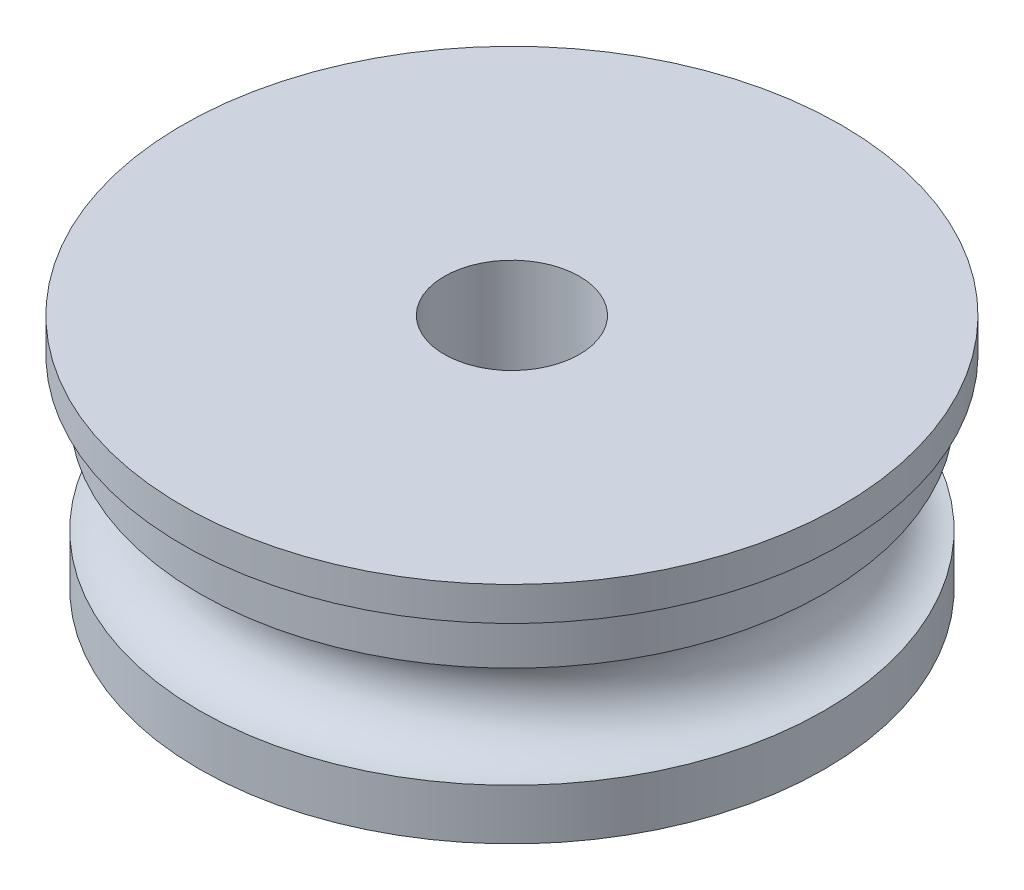
from build123d import *


with BuildPart() as part:
    # Sketch1 → Revolve1 (revolve)
    with BuildSketch(Plane.XY, mode=Mode.PRIVATE) as revolve1_sk:
        with BuildLine():
            Line((2, 7), (9.75, 7))
            Line((9.75, 7), (9.75, 6))
            Line((9.75, 6), (9.25, 6))
            Line((9.25, 6), (9.25, 4.5))
            ThreePointArc((9.25, 4.5), (7.75, 3), (9.25, 1.5))
            Line((9.25, 1.5), (9.25, 0))
            Line((9.25, 0), (6, 0))
            Line((6, 0), (6, 3))
            Line((6, 3), (2, 3))
            Line((2, 3), (2, 7))
        make_face()
    revolve(revolve1_sk.sketch.rotate(Axis((0, 0, 0), (0, 1, 0)), 90), axis=Axis((0, 0, 0), (0, 1, 0)))


solid = part.part
